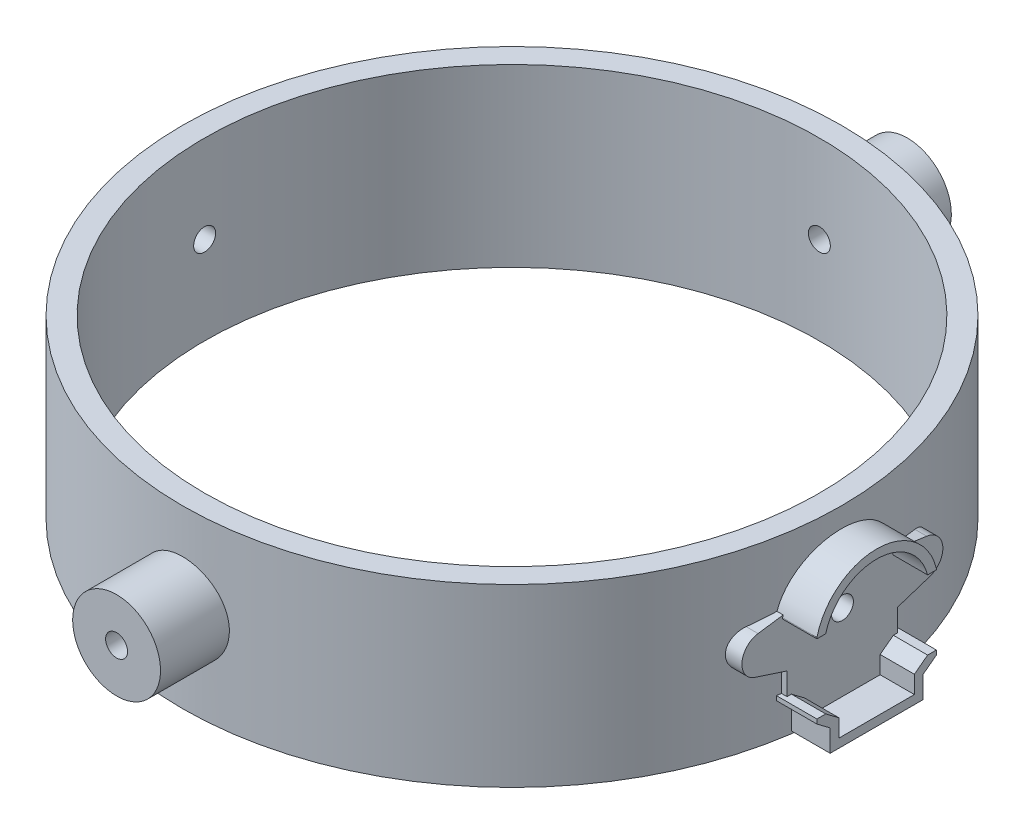
from build123d import *

# Parameters (mm, degrees)
SKETCH1_R                            = 95.25
SKETCH1_R_2                          = 88.9
BOSS_EXTRUDE1_DEPTH                  = 50.8
SKETCH4_R                            = 3.175
CUT_EXTRUDE2_DEPTH                   = 10.16
BOSS_EXTRUDE3_DEPTH                  = 10.16
BOSS_EXTRUDE3_DIRECTION_2_REACH      = 220.96
BOSS_EXTRUDE3_DIRECTION_2_END_RADIUS = 95.25
BOSS_EXTRUDE9_REACH                  = 220.96
BOSS_EXTRUDE9_END_RADIUS             = 95.25
BOSS_EXTRUDE9_DIRECTION_2_DEPTH      = 0.254
SKETCH7_R                            = 3.175
CUT_EXTRUDE3_DEPTH                   = 220.180955111
BOSS_EXTRUDE10_START                 = -0.850464
SKETCH8_R                            = 12.7
SKETCH8_R_2                          = 3.175
BOSS_EXTRUDE10_DEPTH                 = 19.900464


with BuildPart() as part:
    # Sketch1 → Boss-Extrude1 (new body)
    with BuildSketch(Plane(origin=(0, 0, 0), x_dir=(1, 0, 0), z_dir=(0, 1, 0))):
        with Locations(Location((0, 0, 0), (0, 0, 270))):
            Circle(SKETCH1_R)
        with Locations(Location((0, 0, 0), (0, 0, 270))):
            Circle(SKETCH1_R_2, mode=Mode.SUBTRACT)
    extrude(amount=BOSS_EXTRUDE1_DEPTH)

    # Sketch4 → Cut-Extrude2 (cut)
    with BuildSketch(Plane(origin=(0, 0, -95.25), x_dir=(-1, 0, 0), z_dir=(0, 0, -1))):
        with Locations(Location((0, 25.4, 0), (0, 0, 90))):
            Circle(SKETCH4_R)
    cut_extrude2 = extrude(amount=-CUT_EXTRUDE2_DEPTH, mode=Mode.SUBTRACT)

    # Mirror2: Cut-Extrude2 across plane
    add(cut_extrude2.mirror(Plane.XY), mode=Mode.SUBTRACT)

    # Sketch5 → Boss-Extrude3 (add)
    with BuildSketch(Plane(origin=(95.25, 0, 0), x_dir=(0, 0, -1), z_dir=(1, 0, 0))):
        Polygon((14.732, 11.14102204), (10.902119397, 8.255), (10.902119397, 3.175), (-10.902119397, 3.175), (-10.902119397, 8.255), (-14.732, 11.14102204), (-17.272, 11.14102204), (-17.272, 9.874624755), (-13.442119397, 6.988602716), (-13.442119397, 0.635), (13.442119397, 0.635), (13.442119397, 6.988602716), (17.272, 9.874624755), (17.272, 11.14102204), align=None)
        with BuildLine():
            Line((17.272, 31.524764922), (17.272, 31.20702204))
            Line((17.272, 31.20702204), (14.732, 31.20702204))
            ThreePointArc((14.732, 31.20702204), (0, 42.545), (-14.732, 31.20702204))
            Line((-14.732, 31.20702204), (-17.272, 31.20702204))
            Line((-17.272, 31.20702204), (-17.272, 31.524764922))
            ThreePointArc((-17.272, 31.524764922), (0, 45.085), (17.272, 31.524764922))
        make_face()
    extrude(amount=BOSS_EXTRUDE3_DEPTH)

    # Boss-Extrude3 direction 2: up to this cylinder (the profile starts outside it)
    boss_extrude3_direction_2_end = Plane(origin=(0, 20.387773, 0), z_dir=(0, -1, 0)) * Cylinder(BOSS_EXTRUDE3_DIRECTION_2_END_RADIUS, 655.37624, mode=Mode.PRIVATE)
    # Sketch5 → Boss-Extrude3 direction 2 (add, up to the surface)
    with BuildSketch(Plane(origin=(95.25, 0, 0), x_dir=(0, 0, -1), z_dir=(1, 0, 0)), mode=Mode.PRIVATE) as boss_extrude3_direction_2_sk1:
        Polygon((14.732, 11.14102204), (10.902119397, 8.255), (10.902119397, 3.175), (-10.902119397, 3.175), (-10.902119397, 8.255), (-14.732, 11.14102204), (-17.272, 11.14102204), (-17.272, 9.874624755), (-13.442119397, 6.988602716), (-13.442119397, 0.635), (13.442119397, 0.635), (13.442119397, 6.988602716), (17.272, 9.874624755), (17.272, 11.14102204), align=None)
    boss_extrude3_direction_2_tool1 = extrude(boss_extrude3_direction_2_sk1.sketch, amount=-BOSS_EXTRUDE3_DIRECTION_2_REACH, mode=Mode.PRIVATE) - boss_extrude3_direction_2_end
    add(boss_extrude3_direction_2_tool1.solids().sort_by_distance((95.25, 9.409653, -13.034353))[0])
    add(boss_extrude3_direction_2_tool1.solids().sort_by_distance((95.25, 9.409653, -13.034353))[1])
    # Sketch5 → Boss-Extrude3 direction 2 (add, up to the surface)
    with BuildSketch(Plane(origin=(95.25, 0, 0), x_dir=(0, 0, -1), z_dir=(1, 0, 0)), mode=Mode.PRIVATE) as boss_extrude3_direction_2_sk2:
        with BuildLine():
            Line((17.272, 31.524764922), (17.272, 31.20702204))
            Line((17.272, 31.20702204), (14.732, 31.20702204))
            ThreePointArc((14.732, 31.20702204), (0, 42.545), (-14.732, 31.20702204))
            Line((-14.732, 31.20702204), (-17.272, 31.20702204))
            Line((-17.272, 31.20702204), (-17.272, 31.524764922))
            ThreePointArc((-17.272, 31.524764922), (0, 45.085), (17.272, 31.524764922))
        make_face()
    boss_extrude3_direction_2_tool2 = extrude(boss_extrude3_direction_2_sk2.sketch, amount=-BOSS_EXTRUDE3_DIRECTION_2_REACH, mode=Mode.PRIVATE) - boss_extrude3_direction_2_end
    add(boss_extrude3_direction_2_tool2.solids().sort_by_distance((95.25, 31.365893, -16.899725))[0])
    add(boss_extrude3_direction_2_tool2.solids().sort_by_distance((95.25, 31.365893, -16.899725))[1])

    # Boss-Extrude9: up to this cylinder (the profile starts outside it)
    boss_extrude9_end = Plane(origin=(0, 22.775292, 0), z_dir=(0, -1, 0)) * Cylinder(BOSS_EXTRUDE9_END_RADIUS, 633.42, mode=Mode.PRIVATE)
    # Sketch6 → Boss-Extrude9 (add, up to the surface)
    with BuildSketch(Plane(origin=(95.25, 0, 0), x_dir=(0, 0, -1), z_dir=(1, 0, 0)), mode=Mode.PRIVATE) as boss_extrude9_sk1:
        with BuildLine():
            Line((15.720104226, 32.350634064), (24.376259803, 31.134090734))
            ThreePointArc((24.376259803, 31.134090734), (29.020776957, 26.241656743), (25.300667362, 20.614203096))
            Line((25.300667362, 20.614203096), (16.002, 17.585051702))
            Line((16.002, 17.585051702), (16.002, 10.507823398))
            Line((16.002, 10.507823398), (12.172119397, 7.621801358))
            Line((12.172119397, 7.621801358), (12.172119397, 1.905))
            Line((12.172119397, 1.905), (-12.172119397, 1.905))
            Line((-12.172119397, 1.905), (-12.172119397, 7.621801358))
            Line((-12.172119397, 7.621801358), (-16.002, 10.507823398))
            Line((-16.002, 10.507823398), (-16.002, 17.585051702))
            Line((-16.002, 17.585051702), (-25.300667362, 20.614203096))
            ThreePointArc((-25.300667362, 20.614203096), (-29.020776957, 26.241656743), (-24.376259803, 31.134090734))
            Line((-24.376259803, 31.134090734), (-15.720104226, 32.350634064))
            ThreePointArc((-15.720104226, 32.350634064), (0, 43.815), (15.720104226, 32.350634064))
        make_face()
    boss_extrude9_tool1 = extrude(boss_extrude9_sk1.sketch, amount=-BOSS_EXTRUDE9_REACH, mode=Mode.PRIVATE) - boss_extrude9_end
    add(boss_extrude9_tool1.solids().sort_by_distance((95.25, 22.775292, 0))[0])
    add(boss_extrude9_tool1.solids().sort_by_distance((95.25, 22.775292, 0))[1])

    # Sketch6 → Boss-Extrude9 direction 2 (add)
    with BuildSketch(Plane(origin=(95.25, 0, 0), x_dir=(0, 0, -1), z_dir=(1, 0, 0))):
        with BuildLine():
            Line((15.720104226, 32.350634064), (24.376259803, 31.134090734))
            ThreePointArc((24.376259803, 31.134090734), (29.020776957, 26.241656743), (25.300667362, 20.614203096))
            Line((25.300667362, 20.614203096), (16.002, 17.585051702))
            Line((16.002, 17.585051702), (16.002, 10.507823398))
            Line((16.002, 10.507823398), (12.172119397, 7.621801358))
            Line((12.172119397, 7.621801358), (12.172119397, 1.905))
            Line((12.172119397, 1.905), (-12.172119397, 1.905))
            Line((-12.172119397, 1.905), (-12.172119397, 7.621801358))
            Line((-12.172119397, 7.621801358), (-16.002, 10.507823398))
            Line((-16.002, 10.507823398), (-16.002, 17.585051702))
            Line((-16.002, 17.585051702), (-25.300667362, 20.614203096))
            ThreePointArc((-25.300667362, 20.614203096), (-29.020776957, 26.241656743), (-24.376259803, 31.134090734))
            Line((-24.376259803, 31.134090734), (-15.720104226, 32.350634064))
            ThreePointArc((-15.720104226, 32.350634064), (0, 43.815), (15.720104226, 32.350634064))
        make_face()
    extrude(amount=BOSS_EXTRUDE9_DIRECTION_2_DEPTH)

    # Sketch7 → Cut-Extrude3 (cut, through all)
    with BuildSketch(Plane(origin=(95.504, 0, 0), x_dir=(0, 0, -1), z_dir=(1, 0, 0))):
        with Locations((0, 25.4)):
            Circle(SKETCH7_R)
    extrude(amount=-CUT_EXTRUDE3_DEPTH, mode=Mode.SUBTRACT)

    # Sketch8 → Boss-Extrude10 (add)
    with BuildSketch(Plane(origin=(0, 0, -95.25), x_dir=(-1, 0, 0), z_dir=(0, 0, -1)).offset(BOSS_EXTRUDE10_START)):
        with Locations(Location((0, 25.4, 0), (0, 0, 90))):
            Circle(SKETCH8_R)
        with Locations((0, 25.4)):
            Circle(SKETCH8_R_2, mode=Mode.SUBTRACT)
    boss_extrude10 = extrude(amount=BOSS_EXTRUDE10_DEPTH)

    # Mirror3: Boss-Extrude10 across plane
    add(boss_extrude10.mirror(Plane.XY))


solid = part.part
